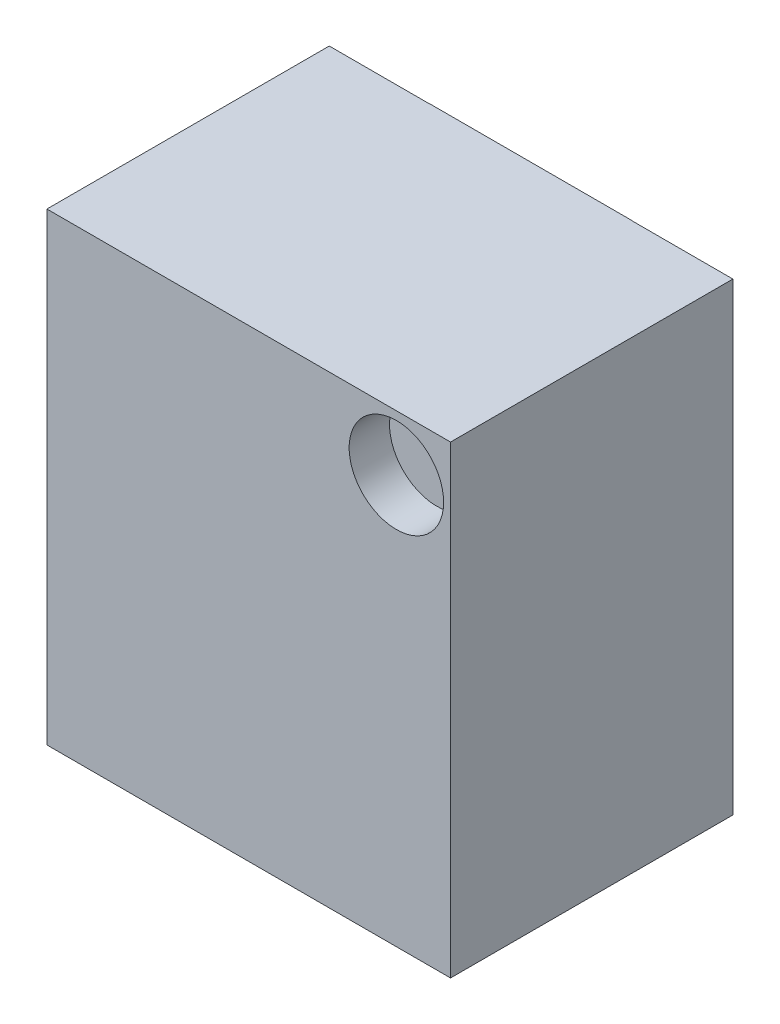
from build123d import *

# Parameters (mm, degrees)
SKETCH1_W           = 2
SKETCH1_H           = 2.3
BOSS_EXTRUDE1_DEPTH = 1.4
SKETCH2_R           = 0.234052446
CUT_EXTRUDE1_DEPTH  = 0.2
SKETCH3_W           = 0.5
SKETCH3_H           = 0.5
CUT_EXTRUDE2_DEPTH  = 0.001


with BuildPart() as part:
    # Sketch1 → Boss-Extrude1 (new body)
    with BuildSketch(Plane.XY):
        Rectangle(SKETCH1_W, SKETCH1_H)
    extrude(amount=BOSS_EXTRUDE1_DEPTH)

    # Sketch2 → Cut-Extrude1 (cut)
    with BuildSketch(Plane.XY.offset(1.4)):
        with Locations((0.731649059, 0.874401574)):
            Circle(SKETCH2_R)
    extrude(amount=-CUT_EXTRUDE1_DEPTH, mode=Mode.SUBTRACT)

    # Sketch3 → Cut-Extrude2 (cut)
    with BuildSketch(Plane(origin=(0, 0, 0), x_dir=(-1, 0, 0), z_dir=(0, 0, -1))):
        with Locations((-0.75, 0.9)):
            Rectangle(SKETCH3_W, SKETCH3_H)
        with Locations((0.75, 0.9)):
            Rectangle(SKETCH3_W, SKETCH3_H)
        with Locations((-0.75, -0.9)):
            Rectangle(SKETCH3_W, SKETCH3_H)
        with Locations((0.75, -0.9)):
            Rectangle(SKETCH3_W, SKETCH3_H)
    extrude(amount=-CUT_EXTRUDE2_DEPTH, mode=Mode.SUBTRACT)


solid = part.part
